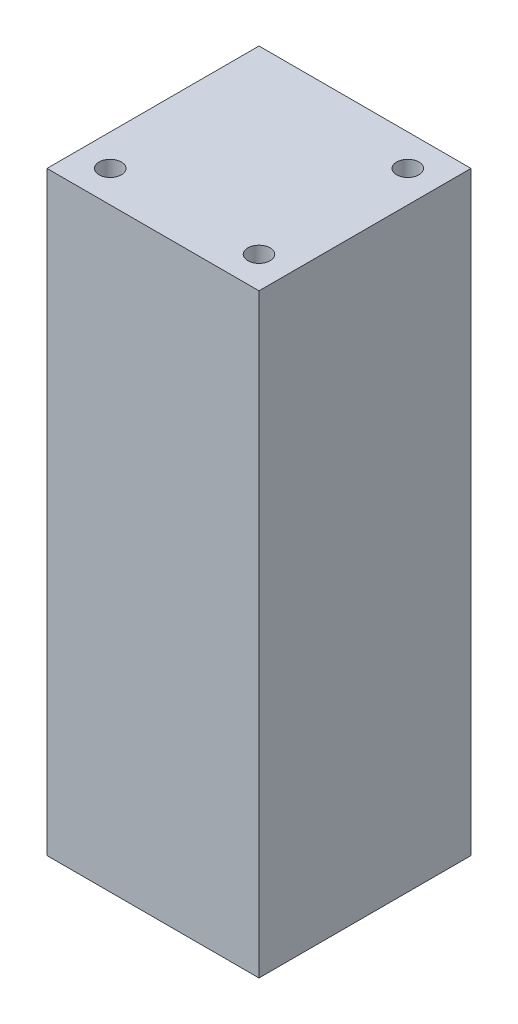
from build123d import *

# Parameters (mm, degrees)
SKETCH1_W           = 28.5
SKETCH1_H           = 28.5
BOSS_EXTRUDE1_DEPTH = 80
SKETCH2_R           = 1.5
CUT_EXTRUDE1_DEPTH  = 12


with BuildPart() as part:
    # Sketch1 → Boss-Extrude1 (new body)
    with BuildSketch(Plane(origin=(0, 0, 0), x_dir=(1, 0, 0), z_dir=(0, 1, 0))):
        Rectangle(SKETCH1_W, SKETCH1_H)
    extrude(amount=BOSS_EXTRUDE1_DEPTH)

    # Sketch2 → Cut-Extrude1 (cut)
    with BuildSketch(Plane(origin=(0, 80, 0), x_dir=(1, 0, 0), z_dir=(0, 1, 0))):
        with Locations(Location((10, 10, 0), (0, 0, 270))):
            Circle(SKETCH2_R)
        with Locations(Location((10, -10, 0), (0, 0, 270))):
            Circle(SKETCH2_R)
        with Locations(Location((-10, -10, 0), (0, 0, 270))):
            Circle(SKETCH2_R)
    extrude(amount=-CUT_EXTRUDE1_DEPTH, mode=Mode.SUBTRACT)


solid = part.part
